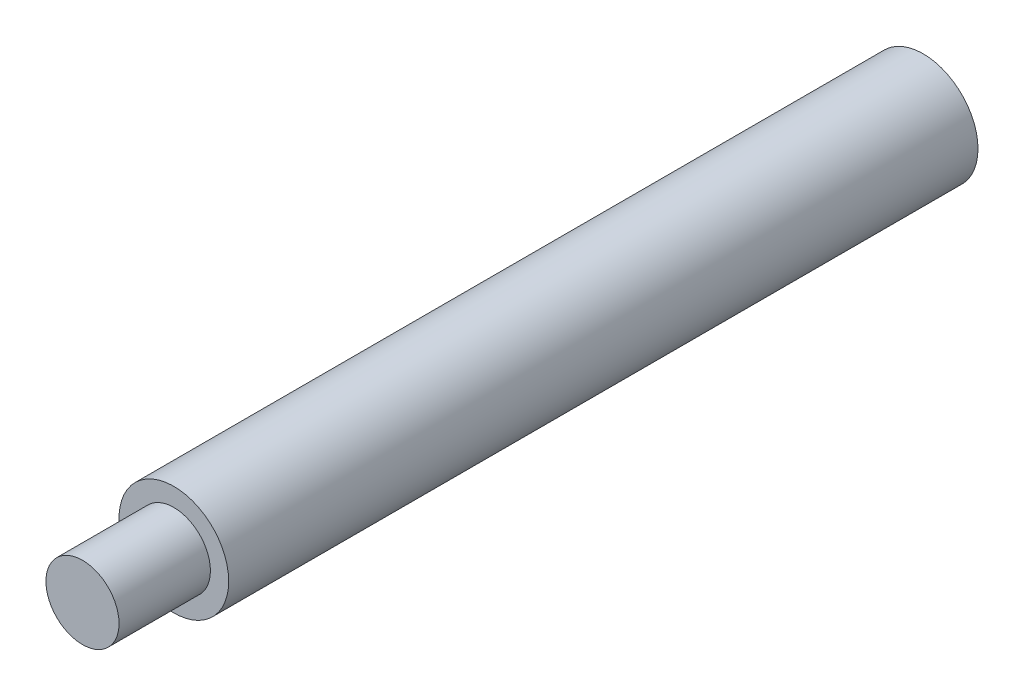
from build123d import *

# Parameters (mm, degrees)
SKETCH1_R           = 1
BOSS_EXTRUDE1_DEPTH = 2.5
SKETCH1_3_R         = 1.5
BOSS_EXTRUDE2_DEPTH = 20.5


with BuildPart() as part:
    # Sketch1 → Boss-Extrude1 (new body)
    with BuildSketch(Plane.XY):
        Circle(SKETCH1_R)
    extrude(amount=BOSS_EXTRUDE1_DEPTH)

    # Sketch1<3> → Boss-Extrude2 (add)
    with BuildSketch(Plane.XY):
        Circle(SKETCH1_3_R)
    extrude(amount=-BOSS_EXTRUDE2_DEPTH)


solid = part.part
